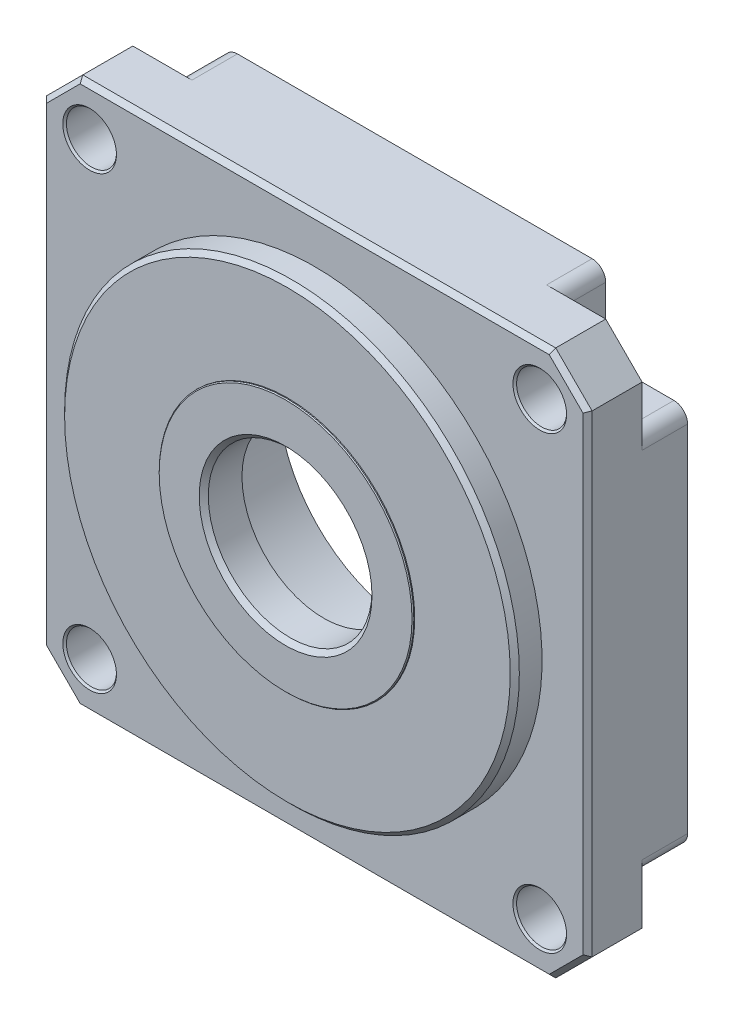
from build123d import *

# Parameters (mm, degrees)
SKETCH1_W                  = 60
SKETCH1_H                  = 60
SKETCH1_R                  = 9
BOSS_EXTRUDE1_DEPTH        = 11
SKETCH2_R                  = 25
SKETCH2_R_2                = 9
BOSS_EXTRUDE2_DEPTH        = 3
SKETCH3_R                  = 14
SKETCH3_R_2                = 9
BOSS_EXTRUDE3_DEPTH        = 0.2
CHAMFER1_SIZE              = 0.5
CHAMFER2_SIZE              = 0.5
F_5_5_5_5_DIAMETER_HOLE1_D = 5.5
CIRPATTERN1_COUNT          = 4
CHAMFER3_SIZE              = 4
CHAMFER4_SIZE              = 4
CHAMFER5_SIZE              = 4
CHAMFER6_SIZE              = 4
CUT_EXTRUDE1_DEPTH         = 5
FILLET3_R                  = 1.5
FILLET4_R                  = 1.5
FILLET5_R                  = 1.5
CHAMFER7_SIZE              = 0.5
CHAMFER8_SIZE              = 0.2
CHAMFER9_SIZE              = 0.1
CHAMFER10_SIZE             = 0.5
SKETCH7_R                  = 15
CUT_EXTRUDE2_DEPTH         = 10
SCALE1_SCALE               = 2.3


with BuildPart() as part:
    # Sketch1 → Boss-Extrude1 (new body)
    with BuildSketch(Plane.XY):
        with Locations((30, 30)):
            Rectangle(SKETCH1_W, SKETCH1_H)
        with Locations((30, 30)):
            Circle(SKETCH1_R, mode=Mode.SUBTRACT)
    extrude(amount=BOSS_EXTRUDE1_DEPTH)

    # Sketch2 → Boss-Extrude2 (add)
    with BuildSketch(Plane.XY.offset(11)):
        with Locations(Location((30, 30, 0), (0, 0, 180))):
            Circle(SKETCH2_R)
        with Locations((30, 30)):
            Circle(SKETCH2_R_2, mode=Mode.SUBTRACT)
    extrude(amount=BOSS_EXTRUDE2_DEPTH)

    # Sketch3 → Boss-Extrude3 (add)
    with BuildSketch(Plane.XY.offset(14)):
        with Locations((30, 30)):
            Circle(SKETCH3_R)
        with Locations((30, 30)):
            Circle(SKETCH3_R_2, mode=Mode.SUBTRACT)
    extrude(amount=BOSS_EXTRUDE3_DEPTH)

    # Chamfer1
    chamfer1_edges = [part.edges().sort_by_distance(p)[0] for p in [
        (55, 30, 14),
    ]]
    chamfer(chamfer1_edges, length=CHAMFER1_SIZE)

    # Chamfer2
    chamfer2_edges = [part.edges().sort_by_distance(p)[0] for p in [
        (21, 30, 14.2),
    ]]
    chamfer(chamfer2_edges, length=CHAMFER2_SIZE)

    # Ø5.5 (5.5) Diameter Hole1 (through all)
    with Locations(Plane.XY.offset(11)):
        with Locations((5.251262658, 54.748737342)):
            f_5_5_5_5_diameter_hole1 = Hole(F_5_5_5_5_DIAMETER_HOLE1_D / 2)

    # CirPattern1: Ø5.5 (5.5) Diameter Hole1 ×4 about axis
    cirpattern1_axis = Axis((30, 30, 0), (0, 0, 1))
    for i in range(1, CIRPATTERN1_COUNT):
        add(f_5_5_5_5_diameter_hole1.rotate(cirpattern1_axis, i * 360 / CIRPATTERN1_COUNT), mode=Mode.SUBTRACT)

    # Chamfer3
    chamfer3_edges = [part.edges().sort_by_distance(p)[0] for p in [
        (0, 60, 5.5),
    ]]
    chamfer(chamfer3_edges, length=CHAMFER3_SIZE)

    # Chamfer4
    chamfer4_edges = [part.edges().sort_by_distance(p)[0] for p in [
        (60, 60, 5.5),
    ]]
    chamfer(chamfer4_edges, length=CHAMFER4_SIZE)

    # Chamfer5
    chamfer5_edges = [part.edges().sort_by_distance(p)[0] for p in [
        (60, 0, 5.5),
    ]]
    chamfer(chamfer5_edges, length=CHAMFER5_SIZE)

    # Chamfer6
    chamfer6_edges = [part.edges().sort_by_distance(p)[0] for p in [
        (0, 0, 5.5),
    ]]
    chamfer(chamfer6_edges, length=CHAMFER6_SIZE)

    # Sketch6 → Cut-Extrude1 (cut)
    with BuildSketch(Plane(origin=(0, 0, 0), x_dir=(-1, 0, 0), z_dir=(0, 0, -1))):
        with BuildLine():
            Line((-9, 68.337846227), (7.306259914, 68.337846227))
            Line((7.306259914, 68.337846227), (7.306259914, 51))
            Line((7.306259914, 51), (-5, 51))
            ThreePointArc((-5, 51), (-7.828427125, 52.171572875), (-9, 55))
            Line((-9, 55), (-9, 68.337846227))
        make_face()
        with BuildLine():
            Line((8.337846227, 9), (8.337846227, -7.306259914))
            Line((8.337846227, -7.306259914), (-9, -7.306259914))
            Line((-9, -7.306259914), (-9, 5))
            ThreePointArc((-9, 5), (-7.828427125, 7.828427125), (-5, 9))
            Line((-5, 9), (8.337846227, 9))
        make_face()
        with BuildLine():
            Line((-51, -8.337846227), (-67.306259914, -8.337846227))
            Line((-67.306259914, -8.337846227), (-67.306259914, 9))
            Line((-67.306259914, 9), (-55, 9))
            ThreePointArc((-55, 9), (-52.171572875, 7.828427125), (-51, 5))
            Line((-51, 5), (-51, -8.337846227))
        make_face()
        with BuildLine():
            Line((-68.337846227, 51), (-68.337846227, 67.306259914))
            Line((-68.337846227, 67.306259914), (-51, 67.306259914))
            Line((-51, 67.306259914), (-51, 55))
            ThreePointArc((-51, 55), (-52.171572875, 52.171572875), (-55, 51))
            Line((-55, 51), (-68.337846227, 51))
        make_face()
    extrude(amount=-CUT_EXTRUDE1_DEPTH, mode=Mode.SUBTRACT)

    # Fillet3
    fillet3_edges = [part.edges().sort_by_distance(p)[0] for p in [
        (60, 51, 2.5),
    ]]
    fillet(fillet3_edges, radius=FILLET3_R)

    # Fillet4
    fillet4_edges = [part.edges().sort_by_distance(p)[0] for p in [
        (51, 60, 2.5),
    ]]
    fillet(fillet4_edges, radius=FILLET4_R)

    # Fillet5
    fillet5_edges = [part.edges().sort_by_distance(p)[0] for p in [
        (9, 0, 2.5),
        (0, 9, 2.5),
        (60, 9, 2.5),
        (51, 0, 2.5),
        (9, 60, 2.5),
        (0, 51, 2.5),
    ]]
    fillet(fillet5_edges, radius=FILLET5_R)

    # Chamfer7
    chamfer7_edges = [part.edges().sort_by_distance(p)[0] for p in [
        (0, 30, 11),
        (2, 58, 11),
        (30, 60, 11),
        (58, 58, 11),
        (60, 30, 11),
        (58, 2, 11),
        (30, 0, 11),
        (2, 2, 11),
    ]]
    chamfer(chamfer7_edges, length=CHAMFER7_SIZE)

    # Chamfer8
    chamfer8_edges = [part.edges().sort_by_distance(p)[0] for p in [
        (8.001262658, 54.748737342, 11),
        (5.251262658, 8.001262658, 11),
        (51.998737342, 5.251262658, 11),
        (54.748737342, 51.998737342, 11),
    ]]
    chamfer(chamfer8_edges, length=CHAMFER8_SIZE)

    # Chamfer9
    chamfer9_edges = [part.edges().sort_by_distance(p)[0] for p in [
        (16, 30, 14.2),
    ]]
    chamfer(chamfer9_edges, length=CHAMFER9_SIZE)

    # Chamfer10
    chamfer10_edges = [part.edges().sort_by_distance(p)[0] for p in [
        (21, 30, 0),
    ]]
    chamfer(chamfer10_edges, length=CHAMFER10_SIZE)

    # Sketch7 → Cut-Extrude2 (cut)
    with BuildSketch(Plane(origin=(0, 0, 0), x_dir=(-1, 0, 0), z_dir=(0, 0, -1))):
        with Locations((-30, 30)):
            Circle(SKETCH7_R)
    extrude(amount=-CUT_EXTRUDE2_DEPTH, mode=Mode.SUBTRACT)


with BuildPart() as part_1:
    # Scale1: scaled about (30, 30, 6.673990553)
    add(part.part.scale(SCALE1_SCALE).moved(Location((-39, -39, -8.676187719))))


solid = part_1.part
